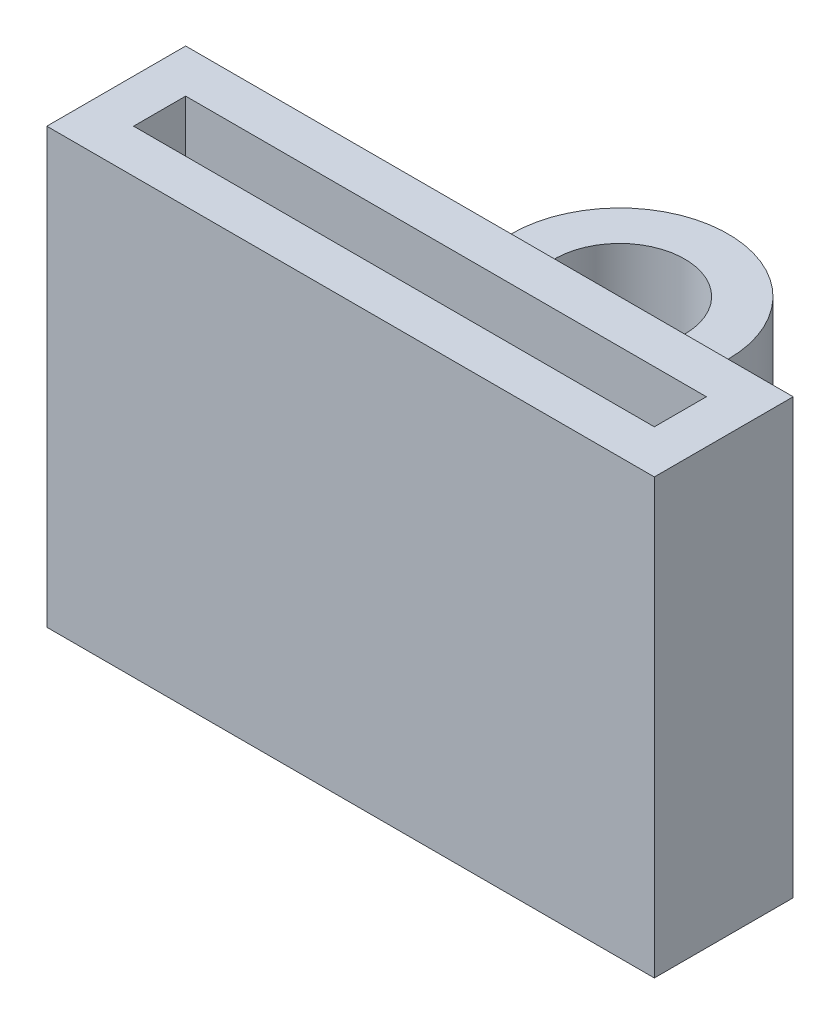
from build123d import *

# Parameters (mm, degrees)
SKETCH1_W                = 12
SKETCH1_H                = 1.2
BOSS_EXTRUDE1_DEPTH      = 5
BOSS_EXTRUDE2_DEPTH      = 2
BOSS_EXTRUDE2_DEPTH_BACK = 5
SKETCH1_3_R              = 1.5


with BuildPart() as part:
    # Sketch1 → Boss-Extrude1 (new, symmetric)
    with BuildSketch(Plane(origin=(0, 0, 0), x_dir=(1, 0, 0), z_dir=(0, 1, 0))):
        Polygon((2.5, 1.6), (-2.5, 1.6), (-7, 1.6), (-7, -1.6), (7, -1.6), (7, 1.6), align=None)
        Rectangle(SKETCH1_W, SKETCH1_H, mode=Mode.SUBTRACT)
    extrude(amount=BOSS_EXTRUDE1_DEPTH, both=True)

    # Sketch1<3> → Boss-Extrude2 (add, two sides: drawn at the far end of the back side and taken through both)
    with BuildSketch(Plane(origin=(0, 0, 0), x_dir=(1, 0, 0), z_dir=(0, 1, 0)).offset(-BOSS_EXTRUDE2_DEPTH_BACK)):
        with BuildLine():
            ThreePointArc((2.5, 4.6), (0, 7.1), (-2.5, 4.6))
            Line((-2.5, 4.6), (-2.5, 1.6))
            Line((-2.5, 1.6), (2.5, 1.6))
            Line((2.5, 1.6), (2.5, 4.6))
        make_face()
        with Locations((0, 4.6)):
            Circle(SKETCH1_3_R, mode=Mode.SUBTRACT)
    extrude(amount=BOSS_EXTRUDE2_DEPTH + BOSS_EXTRUDE2_DEPTH_BACK)


solid = part.part
